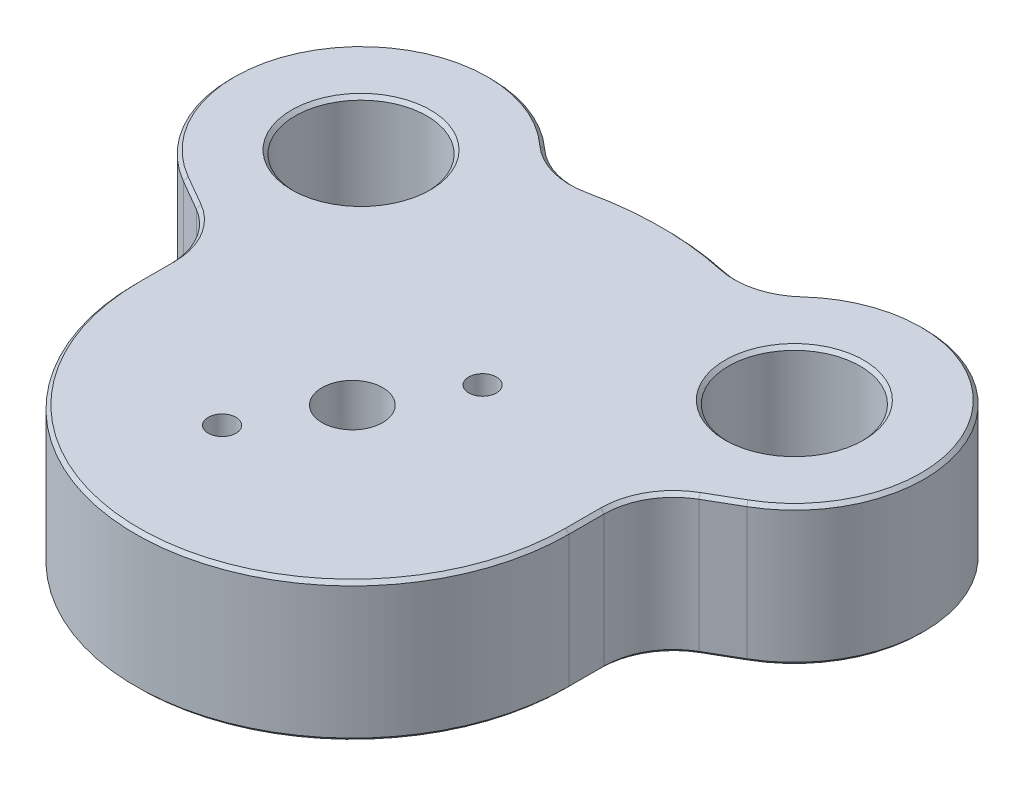
from build123d import *
from build123d.topology import SkipClean

# Parameters (mm, degrees)
BOSS_EXTRUDE1_DEPTH   = 40
CUT_EXTRUDE4_DEPTH    = 149.681707012
FILLET1_R             = 20
CUT_EXTRUDE2_REACH    = 150.682
SKETCH3_R             = 19
M20_TAPPED_HOLE1_D    = 17.5
SKETCH8_R             = 15
CUT_EXTRUDE3_DEPTH    = 10
M6_TAPPED_HOLE1_D     = 5
M6_TAPPED_HOLE1_DEPTH = 17
M6_TAPPED_HOLE1_TIP   = 1.502151548
F_8_0MM_DOWEL_HOLE1_D = 8
CHAMFER1_SIZE         = 1


with BuildPart() as part:
    # Sketch1 → Boss-Extrude1 (new body)
    with BuildSketch(Plane(origin=(0, 0, 0), x_dir=(1, 0, 0), z_dir=(0, 1, 0))):
        with BuildLine():
            Line((-90, 0), (-90, 39.504902432))
            ThreePointArc((-90, 39.504902432), (-85.182396525, 94.862332258), (-30.561841884, 84.652075111))
            ThreePointArc((-30.561841884, 84.652075111), (0, 90), (30.561841884, 84.652075111))
            ThreePointArc((30.561841884, 84.652075111), (85.182396525, 94.862332258), (90, 39.504902432))
            Line((90, 39.504902432), (90, 0))
            ThreePointArc((90, 0), (0, -90), (-90, 0))
        make_face()
    extrude(amount=BOSS_EXTRUDE1_DEPTH)

    # Sketch2 → Cut-Extrude4 (cut, through all)
    with SkipClean():  # the faces are left unmerged after this step: merging them gives an invalid solid
        with BuildSketch(Plane(origin=(0, 0, 0), x_dir=(1, 0, 0), z_dir=(0, 1, 0))):
            with BuildLine():
                Line((-81.25, 32.524047358), (-62.5, 21.698729811))
                Line((-62.5, 21.698729811), (-62.5, 0))
                ThreePointArc((-62.5, 0), (0, -62.5), (62.5, 0))
                Line((62.5, 0), (62.5, 21.698729811))
                Line((62.5, 21.698729811), (81.25, 32.524047358))
                ThreePointArc((81.25, 32.524047358), (85.886934587, 35.68615872), (90, 39.504902432))
                Line((90, 39.504902432), (90, 0))
                ThreePointArc((90, 0), (0, -90), (-90, 0))
                Line((-90, 0), (-90, 39.504902432))
                ThreePointArc((-90, 39.504902432), (-85.886934587, 35.68615872), (-81.25, 32.524047358))
            make_face()
        extrude(amount=CUT_EXTRUDE4_DEPTH, mode=Mode.SUBTRACT)

    # Fillet1
    fillet1_edges = [part.edges().sort_by_distance(p)[0] for p in [
        (30.561841884, 20, -84.652075111),
        (-30.561841884, 20, -84.652075111),
        (-62.5, 20, -21.698729811),
        (62.5, 20, -21.698729811),
    ]]
    fillet(fillet1_edges, radius=FILLET1_R)

    # Sketch3 → Cut-Extrude2 (cut, up to next)
    with BuildSketch(Plane(origin=(0, 0, 0), x_dir=(1, 0, 0), z_dir=(0, 1, 0)), mode=Mode.PRIVATE) as cut_extrude2_sk1:
        with Locations(Location((-62.5, 65, 0), (0, 0, 270))):
            Circle(SKETCH3_R)
    cut_extrude2_tool1 = extrude(cut_extrude2_sk1.sketch, amount=CUT_EXTRUDE2_REACH, mode=Mode.PRIVATE) & part.part
    # Sketch3 → Cut-Extrude2 (cut, up to next)
    with BuildSketch(Plane(origin=(0, 0, 0), x_dir=(1, 0, 0), z_dir=(0, 1, 0)), mode=Mode.PRIVATE) as cut_extrude2_sk2:
        with Locations(Location((62.5, 65, 0), (0, 0, 270))):
            Circle(SKETCH3_R)
    cut_extrude2_tool2 = extrude(cut_extrude2_sk2.sketch, amount=CUT_EXTRUDE2_REACH, mode=Mode.PRIVATE) & part.part
    add(cut_extrude2_tool1.solids().sort_by_distance((-62.5, 0, -65))[0], mode=Mode.SUBTRACT)
    add(cut_extrude2_tool2.solids().sort_by_distance((62.5, 0, -65))[0], mode=Mode.SUBTRACT)

    # M20 Tapped Hole1 (through all)
    with Locations(Plane(origin=(0, 40, 0), x_dir=(1, 0, 0), z_dir=(0, 1, 0))):
        with Locations((0, 0)):
            Hole(M20_TAPPED_HOLE1_D / 2)

    # Sketch8 → Cut-Extrude3 (cut)
    with SkipClean():  # the faces are left unmerged after this step: merging them gives an invalid solid
        with BuildSketch(Plane.XZ):
            with Locations(Location((0, 0, 0), (0, 0, 270))):
                Circle(SKETCH8_R)
        extrude(amount=-CUT_EXTRUDE3_DEPTH, mode=Mode.SUBTRACT)

    # M6 Tapped Hole1
    with Locations(Plane(origin=(0, 0, 0), x_dir=(-1, 0, 0), z_dir=(0, -1, 0))):
        with Locations((-21.650635095, -12.237722392), (21.650635095, -12.5), (0, 25)):
            Hole(M6_TAPPED_HOLE1_D / 2, depth=M6_TAPPED_HOLE1_DEPTH)
            with Locations((0, 0, -(M6_TAPPED_HOLE1_DEPTH + M6_TAPPED_HOLE1_TIP / 2))):  # 118° drill point
                Cone(0, M6_TAPPED_HOLE1_D / 2, M6_TAPPED_HOLE1_TIP, mode=Mode.SUBTRACT)

    # Ø8.0mm Dowel Hole1 (through all)
    with Locations(Plane(origin=(0, 0, 0), x_dir=(-1, 0, 0), z_dir=(0, -1, 0))):
        with Locations((13.75, -23.815698604), (-13.75, 23.815698604)):
            Hole(F_8_0MM_DOWEL_HOLE1_D / 2)

    # Chamfer1
    chamfer1_edges = [part.edges().sort_by_distance(p)[0] for p in [
        (89.102687271, 40, -91.430040295),
        (0, 0, 62.5),
        (-62.5, 0, -5.075862213),
        (76.875, 0, -29.99813993),
        (0, 40, 62.5),
        (-62.5, 40, -5.075862213),
        (76.875, 40, -29.99813993),
        (62.5, 0, -5.075862213),
        (62.5, 40, -5.075862213),
        (-76.875, 0, -29.99813993),
        (-76.875, 40, -29.99813993),
        (0, 0, -90),
        (0, 40, -90),
        (-89.102687271, 0, -91.430040295),
        (-89.102687271, 40, -91.430040295),
        (65.179491924, 0, -20.151724427),
        (65.179491924, 40, -20.151724427),
        (-65.179491924, 0, -20.151724427),
        (-65.179491924, 40, -20.151724427),
        (28.863873105, 0, -88.103017476),
        (28.863873105, 40, -88.103017476),
        (-28.863873105, 0, -88.103017476),
        (-28.863873105, 40, -88.103017476),
        (89.102687271, 0, -91.430040295),
        (-62.5, 0, -84),
        (-62.5, 40, -84),
        (62.5, 0, -84),
        (62.5, 40, -84),
    ]]
    chamfer(chamfer1_edges, length=CHAMFER1_SIZE)


solid = part.part
